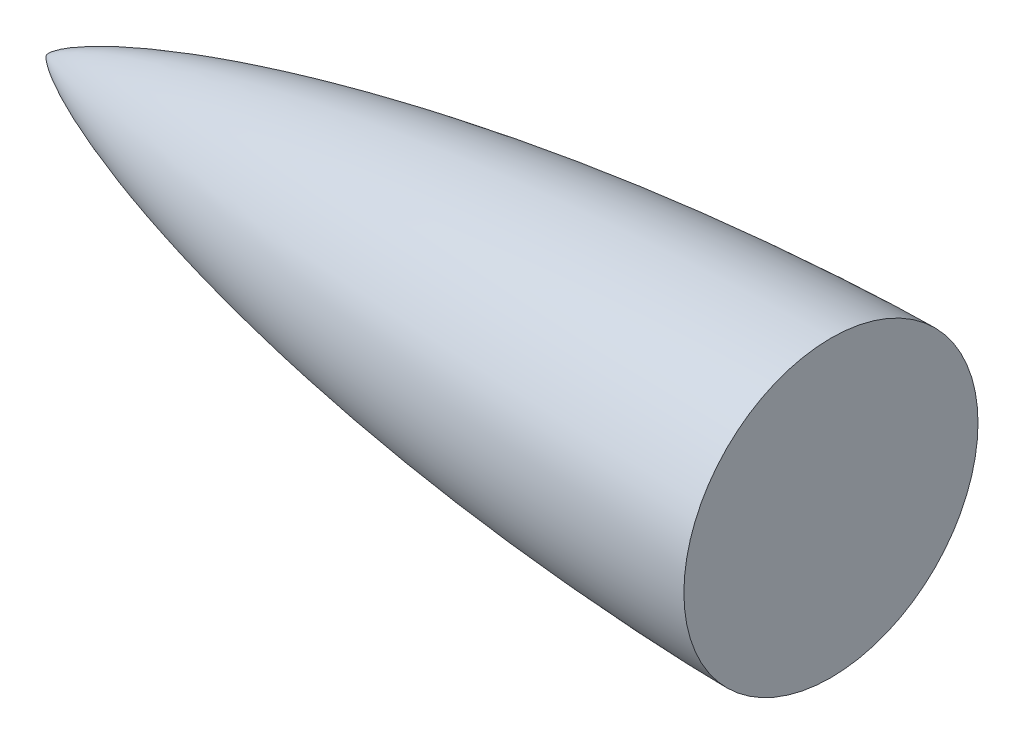
from build123d import *


with BuildPart() as part:
    # Sketch5 → Revolve5 (revolve)
    with BuildSketch(Plane.XY):
        with BuildLine():
            Line((0, 0), (16, 0))
            Line((16, 0), (16, 3))
            add(Edge.make_bspline(
                [(0, 0), (0.001096863, 0.003779096), (0.003631848, 0.009650433), (0.008606384, 0.017181639), (0.016928411, 0.028374239), (0.028408902, 0.041777349), (0.047617455, 0.061593985), (0.080918827, 0.091591353), (0.138407277, 0.136894154), (0.236507893, 0.204146546), (0.397017382, 0.299858917), (0.658856664, 0.435798154), (1.052100326, 0.613030957), (1.643341906, 0.845012811), (2.412412965, 1.105072545), (3.315260305, 1.370271887), (4.31137478, 1.625650098), (5.314326978, 1.852446785), (6.322580328, 2.05427491), (7.335050501, 2.233637642), (8.35096064, 2.392313803), (9.369697413, 2.531614393), (10.390773836, 2.652560887), (11.41377986, 2.755844286), (12.438368255, 2.842062503), (13.464234764, 2.911321396), (14.482896708, 2.963322736), (15.245405405, 2.988684827), (15.751185355, 2.998745499), (16, 3)],
                knots=[0, 0, 0, 0, 0, 0.000954213, 0.001561564, 0.002178138, 0.00339924, 0.005243826, 0.008275842, 0.013078126, 0.021202222, 0.034172623, 0.053733724, 0.084847583, 0.126138222, 0.188699919, 0.251261607, 0.313823298, 0.376385003, 0.438946696, 0.501508396, 0.564070093, 0.626631788, 0.689193487, 0.751755185, 0.814316882, 0.87687858, 0.939440277, 1, 1, 1, 1, 1], degree=4))
        make_face()
    revolve(axis=Axis((0, 0, 0), (1, 0, 0)))


solid = part.part
